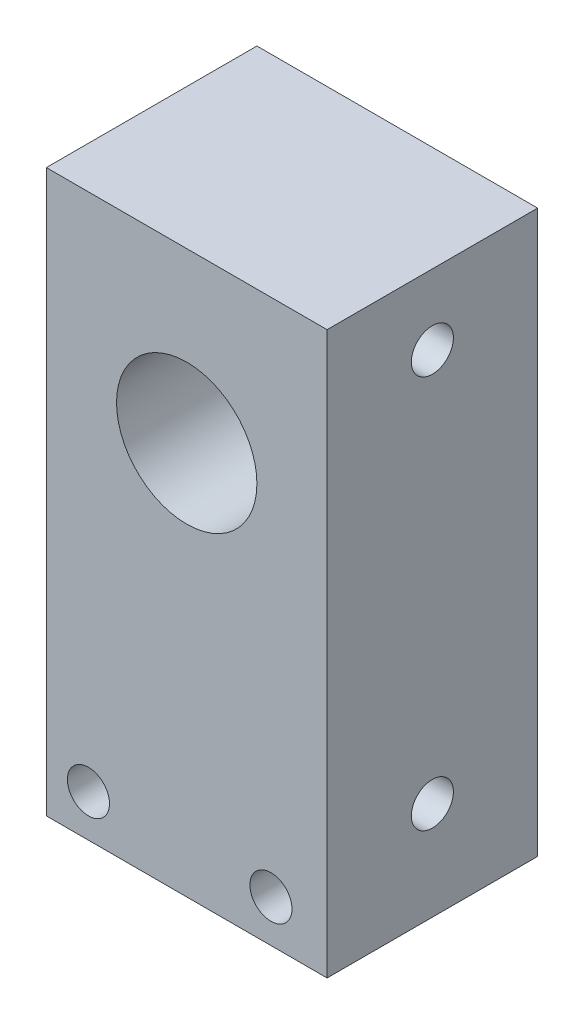
from build123d import *

# Parameters (mm, degrees)
ESQUISSE1_W             = 20
ESQUISSE1_H             = 40
BOSS_EXTRU_1_DEPTH      = 15
ESQUISSE2_R             = 1.5
ENL_V_MAT_EXTRU_1_DEPTH = 10
ESQUISSE3_R             = 1.5
ENL_V_MAT_EXTRU_2_DEPTH = 48.16990566
ESQUISSE4_R             = 5
ENL_V_MAT_EXTRU_3_DEPTH = 48.16990566


with BuildPart() as part:
    # Esquisse1 → Boss.-Extru.1 (new body)
    with BuildSketch(Plane.XY):
        with Locations((10, 20)):
            Rectangle(ESQUISSE1_W, ESQUISSE1_H)
    extrude(amount=BOSS_EXTRU_1_DEPTH)

    # Esquisse2 → Enlèv. mat.-Extru.1 (cut)
    with BuildSketch(Plane(origin=(20, 0, 0), x_dir=(0, 0, -1), z_dir=(1, 0, 0))):
        with Locations(Location((-7.5, 35, 0), (0, 0, 90))):
            Circle(ESQUISSE2_R)
        with Locations(Location((-7.5, 7, 0), (0, 0, 90))):
            Circle(ESQUISSE2_R)
    extrude(amount=-ENL_V_MAT_EXTRU_1_DEPTH, mode=Mode.SUBTRACT)

    # Esquisse3 → Enlèv. mat.-Extru.2 (cut, through all)
    with BuildSketch(Plane(origin=(0, 0, 0), x_dir=(-1, 0, 0), z_dir=(0, 0, -1))):
        with Locations((-16, 3)):
            Circle(ESQUISSE3_R)
        with Locations((-3, 3)):
            Circle(ESQUISSE3_R)
    extrude(amount=-ENL_V_MAT_EXTRU_2_DEPTH, mode=Mode.SUBTRACT)

    # Esquisse4 → Enlèv. mat.-Extru.3 (cut, through all)
    with BuildSketch(Plane(origin=(0, 0, 0), x_dir=(-1, 0, 0), z_dir=(0, 0, -1))):
        with Locations((-10, 28)):
            Circle(ESQUISSE4_R)
    extrude(amount=-ENL_V_MAT_EXTRU_3_DEPTH, mode=Mode.SUBTRACT)


solid = part.part
